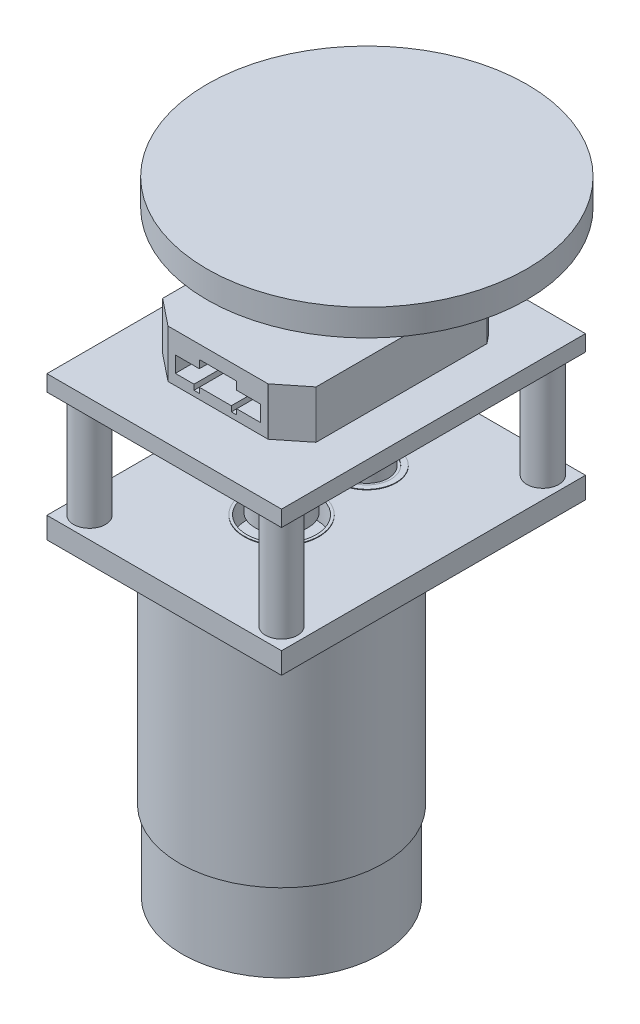
from build123d import *

# Parameters (mm, degrees)
SKETCH_1_R           = 18.6
EXTRUDE_1_DEPTH      = 15
SKETCH_2_R           = 19.1
EXTRUDE_2_DEPTH      = 43
FILLET_4_R           = 1
SKETCH_3_R           = 18.1
CUT_EXTRUDE_1_DEPTH  = 1
SKETCH_4_R           = 7.3
EXTRUDE_3_DEPTH      = 5.7
FILLET_5_R           = 1
SKETCH_5_R           = 4
CUT_EXTRUDE_2_DEPTH  = 2
SKETCH_6_R           = 2.25
EXTRUDE_4_DEPTH      = 2
SKETCH_7_R           = 7
EXTRUDE_5_DEPTH      = 4.1
SKETCH_8_R           = 6.5
CUT_EXTRUDE_3_DEPTH  = 2.6
SKETCH_9_R           = 2.5
EXTRUDE_6_DEPTH      = 3
SKETCH_10_R          = 5
EXTRUDE_7_DEPTH      = 19
SKETCH_12_W          = 44
SKETCH_12_H          = 57
EXTRUDE_8_DEPTH      = 4
SKETCH_13_R          = 3
EXTRUDE_9_DEPTH      = 20
SKETCH_14_R          = 3
EXTRUDE_10_DEPTH     = 20
SKETCH_15_R          = 3
EXTRUDE_11_DEPTH     = 20
SKETCH_16_R          = 3
EXTRUDE_12_DEPTH     = 20
SKETCH_17_W          = 44
SKETCH_17_H          = 57
EXTRUDE_13_DEPTH     = 3
SKETCH_21_R          = 6.5
SKETCH_21_R_2        = 2.5
CUT_EXTRUDE_5_DEPTH  = 4
CUT_EXTRUDE_START    = -4
SKETCH_22_R          = 7
CUT_EXTRUDE_6_DEPTH  = 4
SKETCH_23_R          = 5.5
SKETCH_23_R_2        = 4.5
EXTRUDE_14_DEPTH     = 0.1
SKETCH_24_R          = 4
EXTRUDE_15_DEPTH     = 10
SKETCH_25_R          = 5
EXTRUDE_16_DEPTH     = 3.5
SKETCH_28_R          = 10.9
EXTRUDE_22_DEPTH     = 2
SKETCH_29_R          = 4
EXTRUDE_23_DEPTH     = 4.5
EXTRUDE_START        = 0.1
SKETCH_31_R          = 5.5
SKETCH_31_R_2        = 4.5
EXTRUDE_25_DEPTH     = 0.1
EXTRUDE_26_DEPTH     = 9
CUT_EXTRUDE_7_DEPTH  = 9
CUT_EXTRUDE_8_DEPTH  = 9
SKETCH_39_R          = 2.75
EXTRUDE_27_DEPTH     = 15
CUT_EXTRUDE_9_DEPTH  = 9
SKETCH_41_W          = 1
SKETCH_41_H          = 1
CUT_EXTRUDE_10_DEPTH = 9
SKETCH_42_W          = 1
SKETCH_42_H          = 1
CUT_EXTRUDE_11_DEPTH = 9
FILLET_6_R           = 0.01
FILLET_7_R           = 0.1
SKETCH_43_R          = 7.5
SKETCH_43_R_2        = 7
CUT_EXTRUDE_12_DEPTH = 3
SKETCH_44_R          = 30
EXTRUDE_28_DEPTH     = 5


with BuildPart() as part:
    # ｽｹｯﾁ1 → ﾎﾞｽ - 押し出し1 (new body)
    with BuildSketch(Plane(origin=(0, 0, 0), x_dir=(1, 0, 0), z_dir=(0, 1, 0))):
        with Locations(Location((0, 0, 0), (0, 0, 270))):
            Circle(SKETCH_1_R)
    extrude(amount=EXTRUDE_1_DEPTH)

    # ｽｹｯﾁ2 → ﾎﾞｽ - 押し出し2 (add)
    with BuildSketch(Plane(origin=(0, 15, 0), x_dir=(1, 0, 0), z_dir=(0, 1, 0))):
        with Locations(Location((0, 0, 0), (0, 0, 270))):
            Circle(SKETCH_2_R)
    extrude(amount=EXTRUDE_2_DEPTH)

    # ﾌｨﾚｯﾄ4
    fillet_4_edges = [part.edges().sort_by_distance(p)[0] for p in [
        (0, 58, -19.1),
    ]]
    fillet(fillet_4_edges, radius=FILLET_4_R)

    # ｽｹｯﾁ3 → ｶｯﾄ - 押し出し1 (cut)
    with BuildSketch(Plane.XZ):
        with Locations(Location((0, 0, 0), (0, 0, 270))):
            Circle(SKETCH_3_R)
    extrude(amount=-CUT_EXTRUDE_1_DEPTH, mode=Mode.SUBTRACT)

    # ｽｹｯﾁ4 → ﾎﾞｽ - 押し出し3 (add)
    with BuildSketch(Plane.XZ.offset(-1)):
        with Locations(Location((0, 0, 0), (0, 0, 270))):
            Circle(SKETCH_4_R)
    extrude(amount=EXTRUDE_3_DEPTH)

    # ﾌｨﾚｯﾄ5
    fillet_5_edges = [part.edges().sort_by_distance(p)[0] for p in [
        (0, -4.7, 7.3),
    ]]
    fillet(fillet_5_edges, radius=FILLET_5_R)

    # ｽｹｯﾁ5 → ｶｯﾄ - 押し出し2 (cut)
    with BuildSketch(Plane.XZ.offset(4.7)):
        with Locations(Location((0, 0, 0), (0, 0, 270))):
            Circle(SKETCH_5_R)
    extrude(amount=-CUT_EXTRUDE_2_DEPTH, mode=Mode.SUBTRACT)

    # ｽｹｯﾁ6 → ﾎﾞｽ - 押し出し4 (add)
    with BuildSketch(Plane.XZ.offset(2.7)):
        with Locations(Location((0, 0, 0), (0, 0, 270))):
            Circle(SKETCH_6_R)
    extrude(amount=EXTRUDE_4_DEPTH)

    # ｽｹｯﾁ7 → ﾎﾞｽ - 押し出し5 (add)
    with BuildSketch(Plane(origin=(0, 58, 0), x_dir=(1, 0, 0), z_dir=(0, 1, 0))):
        with Locations(Location((0, 0, 0), (0, 0, 270))):
            Circle(SKETCH_7_R)
    extrude(amount=EXTRUDE_5_DEPTH)

    # ｽｹｯﾁ8 → ｶｯﾄ - 押し出し3 (cut)
    with BuildSketch(Plane(origin=(0, 62.1, 0), x_dir=(1, 0, 0), z_dir=(0, 1, 0))):
        with Locations(Location((0, 0, 0), (0, 0, 270))):
            Circle(SKETCH_8_R)
    extrude(amount=-CUT_EXTRUDE_3_DEPTH, mode=Mode.SUBTRACT)

    # ｽｹｯﾁ9 → ﾎﾞｽ - 押し出し6 (add)
    with BuildSketch(Plane(origin=(0, 59.5, 0), x_dir=(1, 0, 0), z_dir=(0, 1, 0))):
        with Locations(Location((0, 0, 0), (0, 0, 270))):
            Circle(SKETCH_9_R)
    extrude(amount=EXTRUDE_6_DEPTH)

    # ｽｹｯﾁ10 → ﾎﾞｽ - 押し出し7 (add)
    with BuildSketch(Plane(origin=(0, 62.5, 0), x_dir=(1, 0, 0), z_dir=(0, 1, 0))):
        with Locations(Location((0, 0, 0), (0, 0, 270))):
            Circle(SKETCH_10_R)
    extrude(amount=EXTRUDE_7_DEPTH)

    # ｽｹｯﾁ12 → ﾎﾞｽ - 押し出し8 (add)
    with BuildSketch(Plane(origin=(0, 58, 0), x_dir=(1, 0, 0), z_dir=(0, 1, 0))):
        with Locations((0, 6.5)):
            Rectangle(SKETCH_12_W, SKETCH_12_H)
    extrude(amount=EXTRUDE_8_DEPTH)

    # ｽｹｯﾁ13 → ﾎﾞｽ - 押し出し9 (add)
    with BuildSketch(Plane(origin=(0, 62, 0), x_dir=(1, 0, 0), z_dir=(0, 1, 0))):
        with Locations(Location((-18, 31, 0), (0, 0, 270))):
            Circle(SKETCH_13_R)
    extrude(amount=EXTRUDE_9_DEPTH)

    # ｽｹｯﾁ14 → ﾎﾞｽ - 押し出し10 (add)
    with BuildSketch(Plane(origin=(0, 62, 0), x_dir=(1, 0, 0), z_dir=(0, 1, 0))):
        with Locations(Location((-18, -18, 0), (0, 0, 270))):
            Circle(SKETCH_14_R)
    extrude(amount=EXTRUDE_10_DEPTH)

    # ｽｹｯﾁ15 → ﾎﾞｽ - 押し出し11 (add)
    with BuildSketch(Plane(origin=(0, 62, 0), x_dir=(1, 0, 0), z_dir=(0, 1, 0))):
        with Locations(Location((18, 31, 0), (0, 0, 270))):
            Circle(SKETCH_15_R)
    extrude(amount=EXTRUDE_11_DEPTH)

    # ｽｹｯﾁ16 → ﾎﾞｽ - 押し出し12 (add)
    with BuildSketch(Plane(origin=(0, 62, 0), x_dir=(1, 0, 0), z_dir=(0, 1, 0))):
        with Locations(Location((18, -18, 0), (0, 0, 270))):
            Circle(SKETCH_16_R)
    extrude(amount=EXTRUDE_12_DEPTH)

    # ｽｹｯﾁ17 → ﾎﾞｽ - 押し出し13 (add)
    with BuildSketch(Plane(origin=(0, 82, 0), x_dir=(1, 0, 0), z_dir=(0, 1, 0))):
        with Locations((0, 6.5)):
            Rectangle(SKETCH_17_W, SKETCH_17_H)
    extrude(amount=EXTRUDE_13_DEPTH)

    # ｽｹｯﾁ21 → ｶｯﾄ - 押し出し5 (cut)
    with BuildSketch(Plane(origin=(0, 62, 0), x_dir=(1, 0, 0), z_dir=(0, 1, 0))):
        with Locations(Location((0, 0, 0), (0, 0, 270))):
            Circle(SKETCH_21_R)
        with Locations(Location((0, 0, 0), (0, 0, 270))):
            Circle(SKETCH_21_R_2, mode=Mode.SUBTRACT)
    extrude(amount=-CUT_EXTRUDE_5_DEPTH, mode=Mode.SUBTRACT)

    # ｽｹｯﾁ22 → ｶｯﾄ - 押し出し6 (cut)
    with BuildSketch(Plane(origin=(0, 85, 0), x_dir=(1, 0, 0), z_dir=(0, 1, 0)).offset(CUT_EXTRUDE_START)):
        with Locations(Location((0, 0, 0), (0, 0, 270))):
            Circle(SKETCH_22_R)
    extrude(amount=CUT_EXTRUDE_6_DEPTH, mode=Mode.SUBTRACT)

    # ｽｹｯﾁ23 → ﾎﾞｽ - 押し出し14 (add)
    with BuildSketch(Plane(origin=(0, 62, 0), x_dir=(1, 0, 0), z_dir=(0, 1, 0))):
        with Locations(Location((0, 16, 0), (0, 0, 270))):
            Circle(SKETCH_23_R)
        with Locations(Location((0, 16, 0), (0, 0, 270))):
            Circle(SKETCH_23_R_2, mode=Mode.SUBTRACT)
    extrude(amount=EXTRUDE_14_DEPTH)

    # ｽｹｯﾁ24 → ﾎﾞｽ - 押し出し15 (add)
    with BuildSketch(Plane(origin=(0, 62, 0), x_dir=(1, 0, 0), z_dir=(0, 1, 0))):
        with Locations(Location((0, 16, 0), (0, 0, 270))):
            Circle(SKETCH_24_R)
    extrude(amount=EXTRUDE_15_DEPTH)

    # ｽｹｯﾁ25 → ﾎﾞｽ - 押し出し16 (add)
    with BuildSketch(Plane(origin=(0, 72, 0), x_dir=(1, 0, 0), z_dir=(0, 1, 0))):
        with Locations(Location((0, 16, 0), (0, 0, 270))):
            Circle(SKETCH_25_R)
    extrude(amount=EXTRUDE_16_DEPTH)

    # ｽｹｯﾁ28 → ﾎﾞｽ - 押し出し22 (add)
    with BuildSketch(Plane(origin=(0, 75.5, 0), x_dir=(1, 0, 0), z_dir=(0, 1, 0))):
        with Locations(Location((0, 16, 0), (0, 0, 270))):
            Circle(SKETCH_28_R)
    extrude(amount=EXTRUDE_22_DEPTH)

    # ｽｹｯﾁ29 → ﾎﾞｽ - 押し出し23 (add)
    with BuildSketch(Plane(origin=(0, 77.5, 0), x_dir=(1, 0, 0), z_dir=(0, 1, 0))):
        with Locations(Location((0, 16, 0), (0, 0, 270))):
            Circle(SKETCH_29_R)
    extrude(amount=EXTRUDE_23_DEPTH)

    # ｽｹｯﾁ31 → ﾎﾞｽ - 押し出し25 (add)
    with BuildSketch(Plane.XZ.offset(-82).offset(EXTRUDE_START)):
        with Locations(Location((0, -16, 0), (0, 0, 90))):
            Circle(SKETCH_31_R)
        with Locations(Location((0, -16, 0), (0, 0, 90))):
            Circle(SKETCH_31_R_2, mode=Mode.SUBTRACT)
    extrude(amount=-EXTRUDE_25_DEPTH)

    # ｽｹｯﾁ32 → ﾎﾞｽ - 押し出し26 (add)
    with BuildSketch(Plane(origin=(0, 85, 0), x_dir=(1, 0, 0), z_dir=(0, 1, 0))):
        with BuildLine():
            Line((-14.38, 23.72089526), (-14.38, 14.139608929))
            Line((-14.38, 14.139608929), (-14.38, -11.913385086))
            Line((-14.38, -11.913385086), (14.39, -11.913385086))
            Line((14.39, -11.913385086), (14.39, 14.139608929))
            Line((14.39, 14.139608929), (14.39, 24.129341302))
            ThreePointArc((14.39, 24.129341302), (-0.101833491, 31.450223746), (-14.38, 23.72089526))
        make_face()
    extrude(amount=EXTRUDE_26_DEPTH)

    # ｽｹｯﾁ35 → ｶｯﾄ - 押し出し7 (cut)
    with BuildSketch(Plane(origin=(0, 94, 0), x_dir=(1, 0, 0), z_dir=(0, 1, 0))):
        Polygon((14.39, -11.913385086), (14.39, -7.913385086), (9.39, -11.913385086), align=None)
    extrude(amount=-CUT_EXTRUDE_7_DEPTH, mode=Mode.SUBTRACT)

    # ｽｹｯﾁ37 → ｶｯﾄ - 押し出し8 (cut)
    with BuildSketch(Plane(origin=(0, 94, 0), x_dir=(1, 0, 0), z_dir=(0, 1, 0))):
        Polygon((-14.38, -11.913385086), (-9.38, -11.913385086), (-14.38, -7.913385086), align=None)
    extrude(amount=-CUT_EXTRUDE_8_DEPTH, mode=Mode.SUBTRACT)

    # ｽｹｯﾁ39 → ﾎﾞｽ - 押し出し27 (add)
    with BuildSketch(Plane(origin=(0, 94, 0), x_dir=(1, 0, 0), z_dir=(0, 1, 0))):
        with Locations(Location((0, 16, 0), (0, 0, 90))):
            Circle(SKETCH_39_R)
    extrude(amount=EXTRUDE_27_DEPTH)

    # ｽｹｯﾁ40 → ｶｯﾄ - 押し出し9 (cut)
    with BuildSketch(Plane.XY.offset(11.913385086)):
        Polygon((-8, 90), (-3.5, 90), (-3.5, 91.5), (3.5, 91.5), (3.5, 90), (8, 90), (8, 87), (-8, 87), align=None)
    extrude(amount=-CUT_EXTRUDE_9_DEPTH, mode=Mode.SUBTRACT)

    # ｽｹｯﾁ41 → ｶｯﾄ - 押し出し10 (cut)
    with BuildSketch(Plane.XY.offset(11.913385086)):
        with Locations((3, 86.5)):
            Rectangle(SKETCH_41_W, SKETCH_41_H)
    extrude(amount=-CUT_EXTRUDE_10_DEPTH, mode=Mode.SUBTRACT)

    # ｽｹｯﾁ42 → ｶｯﾄ - 押し出し11 (cut)
    with BuildSketch(Plane.XY.offset(11.913385086)):
        with Locations((-4, 86.5)):
            Rectangle(SKETCH_42_W, SKETCH_42_H)
    extrude(amount=-CUT_EXTRUDE_11_DEPTH, mode=Mode.SUBTRACT)

    # ﾌｨﾚｯﾄ6
    fillet_6_edges = [part.edges().sort_by_distance(p)[0] for p in [
        (0, 109, -13.25),
    ]]
    fillet(fillet_6_edges, radius=FILLET_6_R)

    # ﾌｨﾚｯﾄ7
    fillet_7_edges = [part.edges().sort_by_distance(p)[0] for p in [
        (14.39, 89.5, -24.129341302),
        (-14.38, 89.5, -23.72089526),
        (14.39, 89.5, 7.913385086),
        (9.39, 89.5, 11.913385086),
        (-14.38, 89.5, 7.913385086),
        (-9.38, 89.5, 11.913385086),
    ]]
    fillet(fillet_7_edges, radius=FILLET_7_R)

    # ｽｹｯﾁ43 → ｶｯﾄ - 押し出し12 (cut)
    with BuildSketch(Plane(origin=(0, 94, 0), x_dir=(1, 0, 0), z_dir=(0, 1, 0))):
        with Locations(Location((0, 16, 0), (0, 0, 270))):
            Circle(SKETCH_43_R)
        with Locations(Location((0, 16, 0), (0, 0, 270))):
            Circle(SKETCH_43_R_2, mode=Mode.SUBTRACT)
    extrude(amount=-CUT_EXTRUDE_12_DEPTH, mode=Mode.SUBTRACT)

    # ｽｹｯﾁ44 → ﾎﾞｽ - 押し出し28 (add)
    with BuildSketch(Plane(origin=(0, 109, 0), x_dir=(1, 0, 0), z_dir=(0, 1, 0))):
        with Locations(Location((0, 16, 0), (0, 0, 270))):
            Circle(SKETCH_44_R)
    extrude(amount=-EXTRUDE_28_DEPTH)


solid = part.part
